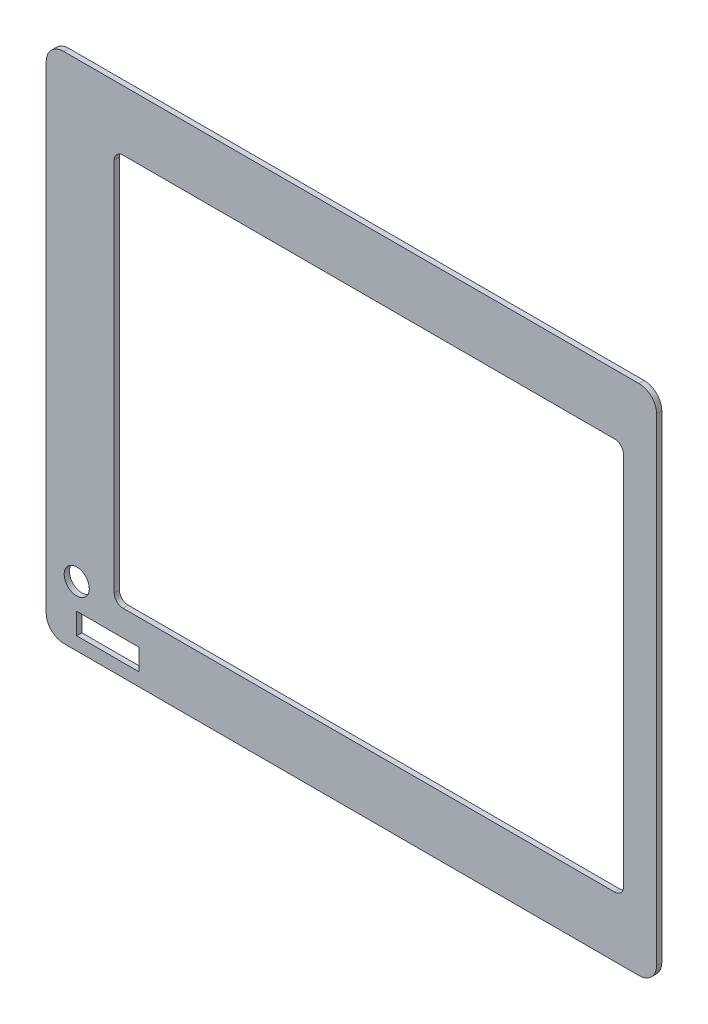
from build123d import *

# Parameters (mm, degrees)
SKETCH1_W           = 700
SKETCH1_H           = 588
BOSS_EXTRUDE1_DEPTH = 6
FILLET1_R           = 20
SKETCH2_R           = 14.4
SKETCH2_W           = 71.3
SKETCH2_H           = 24.4
CUT_EXTRUDE1_DEPTH  = 10


with BuildPart() as part:
    # Sketch1 → Boss-Extrude1 (new body)
    with BuildSketch(Plane.XY):
        Rectangle(SKETCH1_W, SKETCH1_H)
    extrude(amount=BOSS_EXTRUDE1_DEPTH)

    # Fillet1
    fillet1_edges = [part.edges().sort_by_distance(p)[0] for p in [
        (350, -294, 3),
        (-350, -294, 3),
        (-350, 294, 3),
        (350, 294, 3),
    ]]
    fillet(fillet1_edges, radius=FILLET1_R)

    # Sketch2 → Cut-Extrude1 (cut)
    with BuildSketch(Plane.XY.offset(6)):
        with Locations((-315, -225)):
            Circle(SKETCH2_R)
        with Locations((-279.35, -266.8)):
            Rectangle(SKETCH2_W, SKETCH2_H)
        with BuildLine():
            Line((-262, -225), (302, -225))
            ThreePointArc((302, -225), (309.071067812, -222.071067812), (312, -215))
            Line((312, -215), (312, 215))
            ThreePointArc((312, 215), (309.071067812, 222.071067812), (302, 225))
            Line((302, 225), (-262, 225))
            ThreePointArc((-262, 225), (-269.071067812, 222.071067812), (-272, 215))
            Line((-272, 215), (-272, -215))
            ThreePointArc((-272, -215), (-269.071067812, -222.071067812), (-262, -225))
        make_face()
    extrude(amount=-CUT_EXTRUDE1_DEPTH, mode=Mode.SUBTRACT)


solid = part.part
